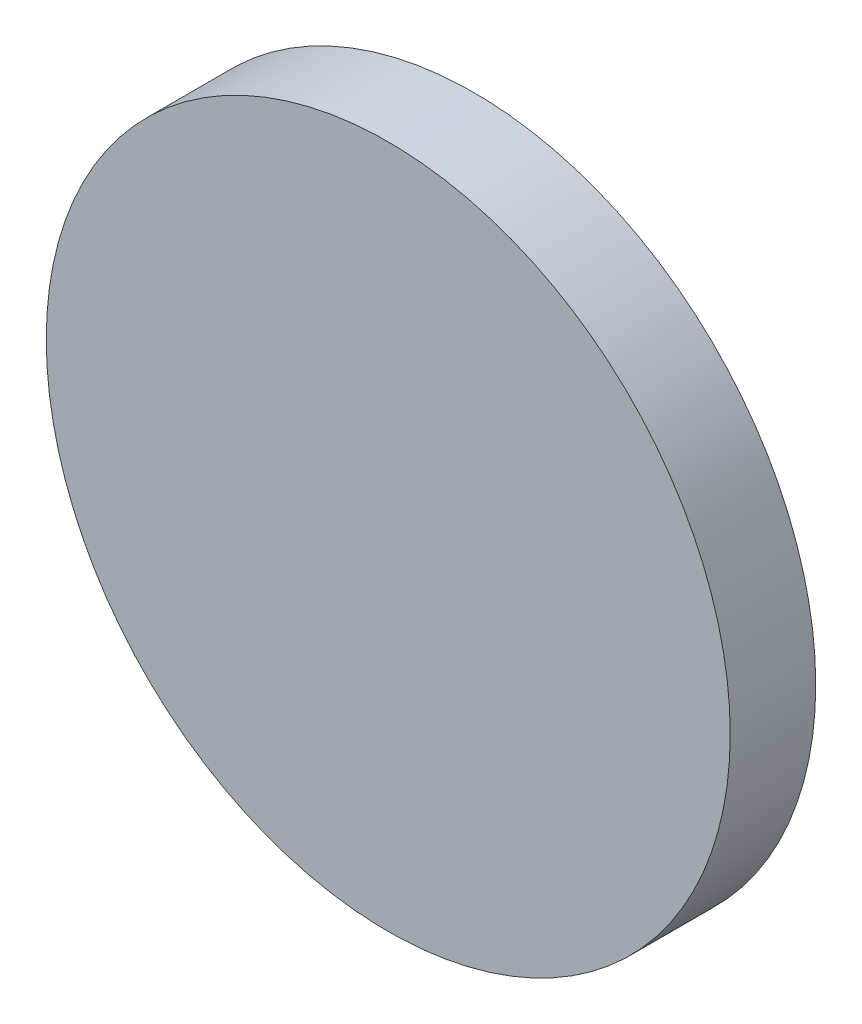
from build123d import *

# Parameters (mm, degrees)
SKETCH1_R           = 4
BOSS_EXTRUDE1_DEPTH = 1


with BuildPart() as part:
    # Sketch1 → Boss-Extrude1 (new body)
    with BuildSketch(Plane.XY):
        Circle(SKETCH1_R)
    extrude(amount=-BOSS_EXTRUDE1_DEPTH)


solid = part.part
